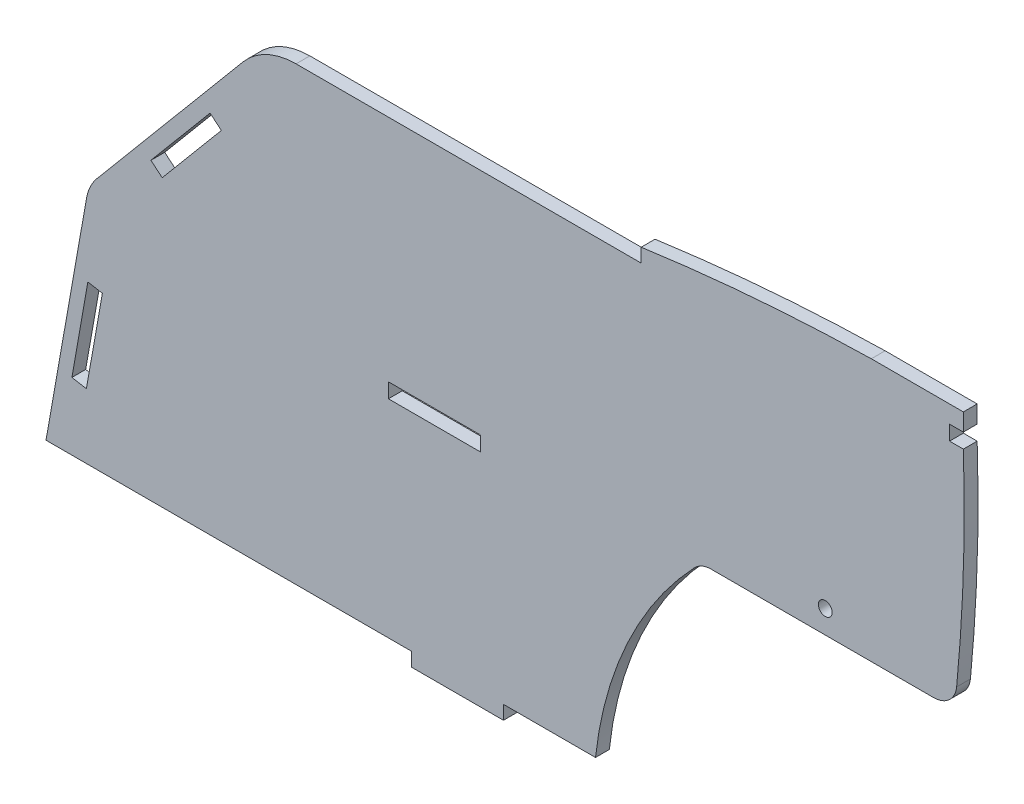
from build123d import *

# Parameters (mm, degrees)
SKETCH1_R           = 1.5
SKETCH1_W           = 20
SKETCH1_H           = 3.2
BOSS_EXTRUDE1_DEPTH = 3
SKETCH2_W           = 3
SKETCH2_H           = 3.2
CUT_EXTRUDE1_DEPTH  = 10


with BuildPart() as part:
    # Sketch1 → Boss-Extrude1 (new body)
    with BuildSketch(Plane.XY):
        with BuildLine():
            Line((-45.069342458, 73), (29.930657542, 73))
            Line((29.930657542, 73), (29.930657542, 76))
            ThreePointArc((29.930657542, 76), (54.871173993, 78.743544354), (79.930657542, 80))
            Line((79.930657542, 80), (99.930657542, 80))
            Line((99.930657542, 80), (99.930657542, 73))
            ThreePointArc((99.930657542, 73), (99.94021491, 50.233693089), (98.469664685, 27.514927635))
            ThreePointArc((98.469664685, 27.514927635), (96.852910392, 24.29693628), (93.493249831, 23))
            Line((93.493249831, 23), (45.108726753, 23))
            ThreePointArc((45.108726753, 23), (43.13391621, 22.593487054), (41.480220087, 21.440049327))
            ThreePointArc((41.480220087, 21.440049327), (26.927174582, -0.016353332), (20, -25))
            Line((20, -25), (0, -25))
            Line((0, -25), (0, -27.9998915))
            Line((0, -27.9998915), (-20, -27.9998915))
            Line((-20, -27.9998915), (-20, -25))
            Line((-20, -25), (-99.408174518, -25))
            Line((-99.408174518, -25), (-90.591825482, 25))
            ThreePointArc((-90.591825482, 25), (-89.806825823, 27.489700841), (-88.404192383, 29.69139432))
            Line((-88.404192383, 29.69139432), (-56.560009105, 67.641814145))
            ThreePointArc((-56.560009105, 67.641814145), (-51.408616384, 71.594616806), (-45.069342458, 73))
        make_face()
        with Locations((69.930657542, 28)):
            Circle(SKETCH1_R, mode=Mode.SUBTRACT)
        with Locations((-15, 21.6)):
            Rectangle(SKETCH1_W, SKETCH1_H, mode=Mode.SUBTRACT)
        Polygon((-76.611843512, 39.077796972), (-74.160501294, 37.020876622), (-61.3047491, 52.341765484), (-63.756091318, 54.398685835), align=None, mode=Mode.SUBTRACT)
        Polygon((-93.782058518, -10.369022063), (-90.309094964, 9.327132997), (-87.157710155, 8.771458829), (-90.630673708, -10.924696232), align=None, mode=Mode.SUBTRACT)
    extrude(amount=BOSS_EXTRUDE1_DEPTH)

    # Sketch2 → Cut-Extrude1 (cut)
    with BuildSketch(Plane.XY.offset(3)):
        with Locations((98.430657542, 74.6)):
            Rectangle(SKETCH2_W, SKETCH2_H)
    extrude(amount=-CUT_EXTRUDE1_DEPTH, mode=Mode.SUBTRACT)


solid = part.part
